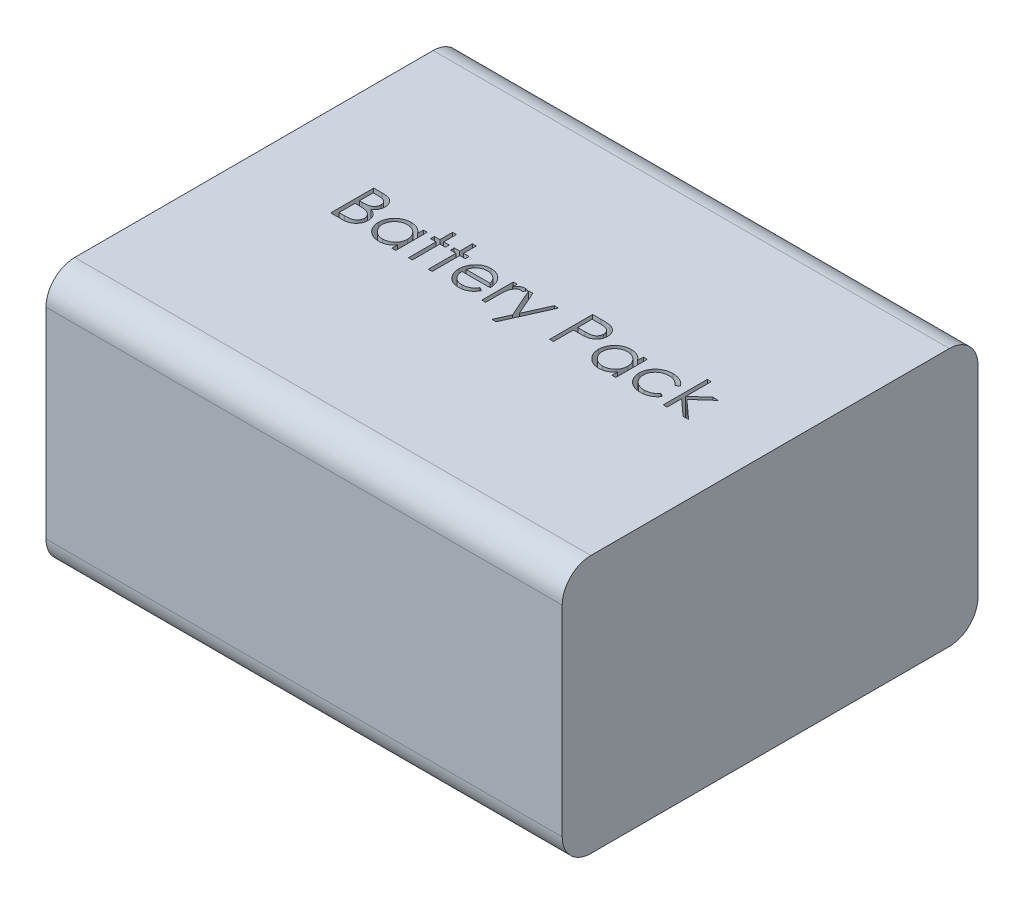
from build123d import *

# Parameters (mm, degrees)
SKETCH1_W           = 57.15
SKETCH1_H           = 46.0375
BOSS_EXTRUDE1_DEPTH = 28.575
FILLET1_R           = 3.175
CUT_EXTRUDE1_DEPTH  = 2.54


with BuildPart() as part:
    # Sketch1 → Boss-Extrude1 (new body)
    with BuildSketch(Plane(origin=(0, 0, 0), x_dir=(1, 0, 0), z_dir=(0, 1, 0))):
        Rectangle(SKETCH1_W, SKETCH1_H)
    extrude(amount=BOSS_EXTRUDE1_DEPTH)

    # Fillet1
    fillet1_edges = [part.edges().sort_by_distance(p)[0] for p in [
        (0, 28.575, -23.01875),
        (0, 0, -23.01875),
        (0, 0, 23.01875),
        (0, 28.575, 23.01875),
    ]]
    fillet(fillet1_edges, radius=FILLET1_R)

    # Sketch2 → Cut-Extrude1 (cut)
    # profile 1 of 11: a face of its own
    with BuildSketch(Plane(origin=(0, 28.575, 0), x_dir=(1, 0, 0), z_dir=(0, 1, 0))):
        with BuildLine():
            Line((-18.676878834, 3.366140696), (-17.747657079, 3.366140696))
            add(Edge.make_bspline(
                [(-17.747657079, 3.366140696), (-17.702170471, 3.36590155), (-17.614006104, 3.365438026), (-17.485800364, 3.358249194), (-17.365718947, 3.348447057), (-17.253727028, 3.332893967), (-17.149876358, 3.314127299), (-17.053853966, 3.291400899), (-16.965965196, 3.264150399), (-16.861036794, 3.22081671), (-16.741401894, 3.156423398), (-16.611864081, 3.061270601), (-16.50109617, 2.944885356), (-16.405592645, 2.813600029), (-16.329663265, 2.669179568), (-16.274732185, 2.515066172), (-16.239955219, 2.353247659), (-16.236378671, 2.24215462), (-16.234571141, 2.186009987)],
                knots=[0, 0, 0, 0, 1.001505555, 1.941167018, 2.826882275, 3.653841531, 4.429895133, 5.150066043, 5.825578002, 6.45369114, 7.647487171, 8.808567382, 9.977351308, 11.170798116, 12.373658725, 13.556498008, 14.765093433, 16, 16, 16, 16], degree=3))
            add(Edge.make_bspline(
                [(-16.234571141, 2.186009987), (-16.236058699, 2.133414902), (-16.238981891, 2.030060601), (-16.266934717, 1.87889326), (-16.310696198, 1.734996065), (-16.371527269, 1.598894177), (-16.450587485, 1.473662724), (-16.544283983, 1.35829148), (-16.657327775, 1.257665221), (-16.742023041, 1.201409342), (-16.785044399, 1.172833905)],
                knots=[0, 0, 0, 0, 1.044552857, 2.05264487, 3.044412934, 4.028983338, 5.005914585, 5.980388656, 6.974128949, 8, 8, 8, 8], degree=3))
            add(Edge.make_bspline(
                [(-16.785044399, 1.172833905), (-16.730941817, 1.152062603), (-16.627430175, 1.112321957), (-16.484982423, 1.042060843), (-16.362253009, 0.965640257), (-16.258298321, 0.882185133), (-16.16939244, 0.79222993), (-16.091759688, 0.694455649), (-16.025518246, 0.587586839), (-15.968758875, 0.472737743), (-15.924469318, 0.351081084), (-15.891300677, 0.223757992), (-15.872294969, 0.091225026), (-15.869590357, 0.001029564), (-15.868224987, -0.044503835)],
                knots=[0, 0, 0, 0, 1.27268992, 2.434971085, 3.483601985, 4.442670788, 5.356604649, 6.2567628, 7.179492994, 8.113709626, 9.066344395, 10.018646069, 10.999752585, 12, 12, 12, 12], degree=3))
            add(Edge.make_bspline(
                [(-15.868224987, -0.044503835), (-15.869554196, -0.090995186), (-15.87216945, -0.182468222), (-15.891464341, -0.316845744), (-15.924133876, -0.445263082), (-15.969134257, -0.568550848), (-16.027865835, -0.686470531), (-16.099341386, -0.799155723), (-16.18456505, -0.905474223), (-16.279900596, -1.006607438), (-16.38775373, -1.097540963), (-16.504116239, -1.178524836), (-16.630453553, -1.245126442), (-16.764690731, -1.301073599), (-16.908333604, -1.343809823), (-17.060737152, -1.373708218), (-17.221769934, -1.393853644), (-17.332273202, -1.395509912), (-17.388943137, -1.396359304)],
                knots=[0, 0, 0, 0, 0.978564426, 1.925352924, 2.850884081, 3.763762016, 4.682927383, 5.618979971, 6.567305752, 7.547517671, 8.540179244, 9.531824382, 10.526200242, 11.540722885, 12.589160233, 13.674978461, 14.80764778, 16, 16, 16, 16], degree=3))
            Line((-17.388943137, -1.396359304), (-18.676878834, -1.396359304))
            Line((-18.676878834, -1.396359304), (-18.676878834, 3.366140696))
        make_face()
        with BuildLine():
            Line((-18.249474987, 2.877679158), (-18.249474987, 1.35123685))
            Line((-18.249474987, 1.35123685), (-17.962313028, 1.35123685))
            add(Edge.make_bspline(
                [(-17.962313028, 1.35123685), (-17.920336632, 1.351781031), (-17.839229679, 1.3528325), (-17.721772963, 1.355844464), (-17.612745706, 1.36427823), (-17.512336105, 1.372709572), (-17.420702279, 1.386418208), (-17.338047239, 1.402736061), (-17.263073791, 1.419993871), (-17.176614624, 1.44934378), (-17.078543933, 1.492720188), (-16.973996031, 1.560037222), (-16.88182877, 1.640216431), (-16.80399974, 1.732732704), (-16.740302703, 1.834604193), (-16.696060826, 1.944205484), (-16.666060772, 2.05880502), (-16.663350867, 2.137479143), (-16.661974987, 2.177423749)],
                knots=[0, 0, 0, 0, 1.156816544, 2.235205308, 3.236616184, 4.169592532, 5.011045266, 5.787822928, 6.49130361, 7.128639758, 8.301311294, 9.436451833, 10.541879658, 11.654887649, 12.756523258, 13.837046038, 14.901820046, 16, 16, 16, 16], degree=3))
            add(Edge.make_bspline(
                [(-16.661974987, 2.177423749), (-16.662690968, 2.203856674), (-16.664095443, 2.255707742), (-16.675597973, 2.331294542), (-16.695148136, 2.402383363), (-16.720259157, 2.46994842), (-16.755350194, 2.531877045), (-16.796666192, 2.590310464), (-16.846584935, 2.64325874), (-16.903404707, 2.692747236), (-16.968730726, 2.736622826), (-17.04252402, 2.775050435), (-17.125782966, 2.805994135), (-17.217104386, 2.833094328), (-17.317893973, 2.8521284), (-17.426988633, 2.867985331), (-17.545281948, 2.876058097), (-17.627122248, 2.877126752), (-17.669426911, 2.877679158)],
                knots=[0, 0, 0, 0, 0.91205012, 1.789085906, 2.630437955, 3.453916878, 4.269457761, 5.079663411, 5.91843418, 6.774407191, 7.675494373, 8.627863946, 9.638891023, 10.736472738, 11.911756761, 13.175263542, 14.539845004, 16, 16, 16, 16], degree=3))
            Line((-17.669426911, 2.877679158), (-18.249474987, 2.877679158))
        make_face(mode=Mode.SUBTRACT)
        with BuildLine():
            Line((-18.249474987, 0.862775312), (-18.249474987, -0.907897765))
            Line((-18.249474987, -0.907897765), (-17.640806117, -0.907897765))
            add(Edge.make_bspline(
                [(-17.640806117, -0.907897765), (-17.597237507, -0.907375595), (-17.513264756, -0.90636918), (-17.392023439, -0.903083661), (-17.27965143, -0.895610243), (-17.176661502, -0.883845712), (-17.081941565, -0.871084322), (-16.996627905, -0.853923972), (-16.920028952, -0.834263065), (-16.831209269, -0.803872638), (-16.731191995, -0.756660654), (-16.623408651, -0.685475939), (-16.52757869, -0.600671724), (-16.44620082, -0.502522158), (-16.379508146, -0.395799531), (-16.330991259, -0.282662466), (-16.301067986, -0.164980373), (-16.297445534, -0.084743525), (-16.295628834, -0.044503835)],
                knots=[0, 0, 0, 0, 1.160039823, 2.235823828, 3.228722157, 4.157150951, 4.99529583, 5.772374946, 6.472645482, 7.099169577, 8.269452708, 9.405989375, 10.527446681, 11.663510218, 12.788923519, 13.866172445, 14.929861265, 16, 16, 16, 16], degree=3))
            add(Edge.make_bspline(
                [(-16.295628834, -0.044503835), (-16.296004533, -0.019339682), (-16.296749871, 0.030582723), (-16.307990208, 0.103946748), (-16.324337652, 0.17501124), (-16.345471496, 0.243969166), (-16.376250128, 0.309573796), (-16.412181891, 0.373122636), (-16.454311512, 0.434699691), (-16.519958038, 0.512549222), (-16.61544206, 0.602243443), (-16.751114494, 0.690060544), (-16.905381799, 0.760882739), (-17.017269923, 0.790953812), (-17.075068437, 0.806487752)],
                knots=[0, 0, 0, 0, 0.723448775, 1.435228256, 2.130040452, 2.821711965, 3.505591119, 4.210454504, 4.921174351, 5.648778258, 7.137944449, 8.670945889, 10.280296675, 12, 12, 12, 12], degree=3))
            add(Edge.make_bspline(
                [(-17.075068437, 0.806487752), (-17.098240171, 0.811189134), (-17.14848127, 0.8213827), (-17.230406585, 0.832142825), (-17.323936463, 0.841729138), (-17.429286879, 0.848820035), (-17.546591119, 0.856149582), (-17.676099712, 0.859000035), (-17.817283773, 0.862400814), (-17.915244822, 0.862647286), (-17.966129134, 0.862775312)],
                knots=[0, 0, 0, 0, 0.634451884, 1.375622551, 2.216452059, 3.157844607, 4.20941857, 5.370758133, 6.634282058, 8, 8, 8, 8], degree=3))
            Line((-17.966129134, 0.862775312), (-18.249474987, 0.862775312))
        make_face(mode=Mode.SUBTRACT)
    # profile 2 of 11: a face of its own
    with BuildSketch(Plane(origin=(0, 28.575, 0), x_dir=(1, 0, 0), z_dir=(0, 1, 0))):
        with BuildLine():
            Line((-11.472071141, 2.083929158), (-11.472071141, -1.396359304))
            Line((-11.472071141, -1.396359304), (-11.899474987, -1.396359304))
            Line((-11.899474987, -1.396359304), (-11.899474987, -0.794368619))
            add(Edge.make_bspline(
                [(-11.899474987, -0.794368619), (-11.947669842, -0.848851066), (-12.041722706, -0.955174247), (-12.198805085, -1.094078918), (-12.365313212, -1.208893705), (-12.540438939, -1.301626269), (-12.72402412, -1.371284032), (-12.915661796, -1.420795198), (-13.115430139, -1.452627524), (-13.25184495, -1.455806182), (-13.320974387, -1.457416996)],
                knots=[0, 0, 0, 0, 1.074387032, 2.096679803, 3.090159297, 4.057316773, 5.018401886, 5.985159533, 6.978961417, 8, 8, 8, 8], degree=3))
            add(Edge.make_bspline(
                [(-13.320974387, -1.457416996), (-13.382435067, -1.455748254), (-13.503638249, -1.45245742), (-13.681931386, -1.426927286), (-13.853506911, -1.385928118), (-14.018526955, -1.328912979), (-14.175923695, -1.253283361), (-14.327044756, -1.162739735), (-14.47110724, -1.054915605), (-14.605915298, -0.931651181), (-14.730055985, -0.797763716), (-14.838996502, -0.654962811), (-14.929828371, -0.503865962), (-15.005783553, -0.346386206), (-15.064289293, -0.181311262), (-15.105074845, -0.009211973), (-15.130575239, 0.169708177), (-15.133864712, 0.291545885), (-15.13553268, 0.353325191)],
                knots=[0, 0, 0, 0, 1.033919861, 2.038935746, 3.024066025, 3.998881131, 4.97069526, 5.957263378, 6.95902576, 7.993208707, 9.027059324, 10.027763471, 11.009749337, 11.988697705, 12.965288445, 13.950418724, 14.960734635, 16, 16, 16, 16], degree=3))
            add(Edge.make_bspline(
                [(-15.13553268, 0.353325191), (-15.133827744, 0.413827588), (-15.130457177, 0.533437562), (-15.105347617, 0.709348934), (-15.06312328, 0.87878271), (-15.003867102, 1.041193408), (-14.927882156, 1.196777547), (-14.835451438, 1.345645167), (-14.726568272, 1.488206383), (-14.601039104, 1.621109016), (-14.465056434, 1.743873495), (-14.319584197, 1.850565803), (-14.168241089, 1.942709087), (-14.008679635, 2.015716139), (-13.843261539, 2.074783527), (-13.670514172, 2.115649816), (-13.491156274, 2.139730814), (-13.369385283, 2.143218004), (-13.307618016, 2.14498685)],
                knots=[0, 0, 0, 0, 1.020392517, 2.01726096, 2.990465484, 3.961182959, 4.928053699, 5.906110375, 6.912531644, 7.948652711, 8.985773172, 9.998621852, 10.987621588, 11.969261332, 12.953316658, 13.946091881, 14.958173133, 16, 16, 16, 16], degree=3))
            add(Edge.make_bspline(
                [(-13.307618016, 2.14498685), (-13.236588922, 2.143030481), (-13.097304221, 2.139194134), (-12.89356718, 2.107268065), (-12.700829516, 2.053331437), (-12.517603415, 1.979965127), (-12.344546839, 1.882471678), (-12.183298135, 1.759490374), (-12.032169745, 1.61179683), (-11.944566563, 1.498353475), (-11.899474987, 1.439961309)],
                knots=[0, 0, 0, 0, 1.038897134, 2.037228247, 3.008116434, 3.962042015, 4.918381754, 5.904844433, 6.921570401, 8, 8, 8, 8], degree=3))
            Line((-11.899474987, 1.439961309), (-11.899474987, 2.083929158))
            Line((-11.899474987, 2.083929158), (-11.472071141, 2.083929158))
        make_face()
        with BuildLine():
            add(Edge.make_bspline(
                [(-13.301893858, 1.717583004), (-13.364370153, 1.71536009), (-13.487688423, 1.710972411), (-13.668723297, 1.676718476), (-13.841960479, 1.61972551), (-14.00653353, 1.541781209), (-14.159842782, 1.443770678), (-14.296858098, 1.325223367), (-14.418700131, 1.189373716), (-14.521173162, 1.036834773), (-14.604708088, 0.873306728), (-14.663446085, 0.70236776), (-14.702184597, 0.527100987), (-14.706142262, 0.408225332), (-14.708128834, 0.348555059)],
                knots=[0, 0, 0, 0, 1.031046209, 2.035121221, 3.029706178, 4.034933723, 5.034054252, 6.02443088, 7.017295772, 8.038157696, 9.050218397, 10.03989886, 11.016116709, 12, 12, 12, 12], degree=3))
            add(Edge.make_bspline(
                [(-14.708128834, 0.348555059), (-14.705591247, 0.289241378), (-14.700526019, 0.170846504), (-14.664125967, -0.004659209), (-14.603057282, -0.175638459), (-14.519724333, -0.340640025), (-14.415375747, -0.493834819), (-14.294423687, -0.632274057), (-14.155698483, -0.75132239), (-14.002036411, -0.850977803), (-13.837923423, -0.93148109), (-13.66533868, -0.987495764), (-13.487526473, -1.02366053), (-13.366623833, -1.027884836), (-13.305709963, -1.03001315)],
                knots=[0, 0, 0, 0, 0.979072187, 1.954306742, 2.945804271, 3.96968567, 4.997920485, 5.998718438, 6.996577872, 8.005894225, 9.015743152, 10.005417472, 10.995077863, 12, 12, 12, 12], degree=3))
            add(Edge.make_bspline(
                [(-13.305709963, -1.03001315), (-13.243870258, -1.027754413), (-13.120877217, -1.02326201), (-12.939305261, -0.988861431), (-12.763099615, -0.932026031), (-12.594660565, -0.853241862), (-12.437748258, -0.755600603), (-12.296917217, -0.641290954), (-12.177832989, -0.508344835), (-12.076878045, -0.362236162), (-11.997717925, -0.202063766), (-11.940056216, -0.031519743), (-11.905965008, 0.149401847), (-11.90166824, 0.27304169), (-11.899474987, 0.336152716)],
                knots=[0, 0, 0, 0, 1.01762866, 2.023962475, 3.030623092, 4.058876274, 5.077231937, 6.066672613, 7.034107872, 8.005628644, 8.981990164, 9.965428785, 10.961468474, 12, 12, 12, 12], degree=3))
            add(Edge.make_bspline(
                [(-11.899474987, 0.336152716), (-11.900780806, 0.384237406), (-11.903351069, 0.478883295), (-11.922986951, 0.617849667), (-11.954222047, 0.750837344), (-11.998235943, 0.877986146), (-12.056054441, 0.998593077), (-12.125788008, 1.113524123), (-12.208662923, 1.222181528), (-12.303345092, 1.323069064), (-12.406984171, 1.415089357), (-12.516650314, 1.497227842), (-12.633642823, 1.564703993), (-12.75599422, 1.620549438), (-12.883916786, 1.66498921), (-13.018451451, 1.694636036), (-13.158168215, 1.714992758), (-13.253480883, 1.716710498), (-13.301893858, 1.717583004)],
                knots=[0, 0, 0, 0, 1.050140795, 2.067009409, 3.05949893, 4.030605086, 5.00011959, 5.97591094, 6.962425594, 7.979863591, 8.993523472, 9.986985069, 10.967611495, 11.937549037, 12.921786183, 13.919465291, 14.943216303, 16, 16, 16, 16], degree=3))
        make_face(mode=Mode.SUBTRACT)
    # profile 3 of 11: a face of its own
    with BuildSketch(Plane(origin=(0, 28.575, 0), x_dir=(1, 0, 0), z_dir=(0, 1, 0))):
        Polygon((-10.067744218, 3.488256081), (-9.640340372, 3.488256081), (-9.640340372, 2.083929158), (-9.029763449, 2.083929158), (-9.029763449, 1.656525312), (-9.640340372, 1.656525312), (-9.640340372, -1.396359304), (-10.067744218, -1.396359304), (-10.067744218, 1.656525312), (-10.678321141, 1.656525312), (-10.678321141, 2.083929158), (-10.067744218, 2.083929158), align=None)
    # profile 4 of 11: a face of its own
    with BuildSketch(Plane(origin=(0, 28.575, 0), x_dir=(1, 0, 0), z_dir=(0, 1, 0))):
        Polygon((-7.869667295, 3.488256081), (-7.442263449, 3.488256081), (-7.442263449, 2.083929158), (-6.831686526, 2.083929158), (-6.831686526, 1.656525312), (-7.442263449, 1.656525312), (-7.442263449, -1.396359304), (-7.869667295, -1.396359304), (-7.869667295, 1.656525312), (-8.480244218, 1.656525312), (-8.480244218, 2.083929158), (-7.869667295, 2.083929158), align=None)
    # profile 5 of 11: a face of its own
    with BuildSketch(Plane(origin=(0, 28.575, 0), x_dir=(1, 0, 0), z_dir=(0, 1, 0))):
        with BuildLine():
            Line((-3.24263905, -0.297320842), (-2.862936526, -0.496712369))
            add(Edge.make_bspline(
                [(-2.862936526, -0.496712369), (-2.893194179, -0.550383473), (-2.952063589, -0.654806188), (-3.053301749, -0.798268827), (-3.159426677, -0.927329468), (-3.275228862, -1.038540177), (-3.397243675, -1.135492954), (-3.526147752, -1.220316923), (-3.662612179, -1.292596052), (-3.806643411, -1.353491456), (-3.959451015, -1.400312946), (-4.121405292, -1.433384047), (-4.292816506, -1.453826423), (-4.410308986, -1.456201061), (-4.470471081, -1.457416996)],
                knots=[0, 0, 0, 0, 1.120438281, 2.179929193, 3.190490725, 4.156257408, 5.095198341, 6.022838206, 6.959905092, 7.901321166, 8.864066838, 9.862729781, 10.905609505, 12, 12, 12, 12], degree=3))
            add(Edge.make_bspline(
                [(-4.470471081, -1.457416996), (-4.537339272, -1.455856018), (-4.667779741, -1.452811003), (-4.857653468, -1.426559471), (-5.036423319, -1.383734583), (-5.204079244, -1.323910042), (-5.360210667, -1.245767862), (-5.505127901, -1.150572996), (-5.639593042, -1.038814463), (-5.759368841, -0.909524231), (-5.867197124, -0.771164139), (-5.962346186, -0.626988454), (-6.041890048, -0.477359923), (-6.106595564, -0.323231103), (-6.158853612, -0.165573448), (-6.195275448, -0.002952487), (-6.216270927, 0.164191648), (-6.219488262, 0.277263379), (-6.221109603, 0.334244663)],
                knots=[0, 0, 0, 0, 1.145258523, 2.234067595, 3.276747158, 4.290159414, 5.277019952, 6.260822364, 7.254936242, 8.264827045, 9.274100331, 10.257902744, 11.220704747, 12.172965371, 13.118907548, 14.062713208, 15.023725156, 16, 16, 16, 16], degree=3))
            add(Edge.make_bspline(
                [(-6.221109603, 0.334244663), (-6.219668414, 0.3877137), (-6.216812168, 0.49368227), (-6.198808847, 0.650525743), (-6.16690242, 0.802964459), (-6.123119636, 0.951125083), (-6.066580262, 1.094759544), (-5.997412135, 1.233955259), (-5.915507506, 1.36856411), (-5.852271475, 1.453476946), (-5.820418497, 1.496248869)],
                knots=[0, 0, 0, 0, 1.024358464, 2.0301432, 3.019427413, 4.004406732, 4.986367066, 5.972626655, 6.978780325, 8, 8, 8, 8], degree=3))
            add(Edge.make_bspline(
                [(-5.820418497, 1.496248869), (-5.7772734, 1.547777582), (-5.692349934, 1.649202708), (-5.548717893, 1.782468787), (-5.393187983, 1.894106924), (-5.227709306, 1.986645206), (-5.050358604, 2.056958275), (-4.86351989, 2.109356093), (-4.665065717, 2.1387176), (-4.529395399, 2.142864831), (-4.45997679, 2.14498685)],
                knots=[0, 0, 0, 0, 1.030682036, 2.02871468, 2.997146059, 3.962720338, 4.930598197, 5.918074684, 6.934738563, 8, 8, 8, 8], degree=3))
            add(Edge.make_bspline(
                [(-4.45997679, 2.14498685), (-4.388610585, 2.143144376), (-4.248606357, 2.139529863), (-4.044455507, 2.106020459), (-3.851287532, 2.052881091), (-3.669179731, 1.97783254), (-3.498113642, 1.881004721), (-3.339201196, 1.761068858), (-3.189724674, 1.621707104), (-3.102763357, 1.51453288), (-3.058511947, 1.459995865)],
                knots=[0, 0, 0, 0, 1.056321875, 2.072262726, 3.055038591, 4.01806755, 4.982017516, 5.957941055, 6.960871419, 8, 8, 8, 8], degree=3))
            add(Edge.make_bspline(
                [(-3.058511947, 1.459995865), (-3.028403506, 1.41889742), (-2.968387034, 1.336974094), (-2.893211516, 1.203391198), (-2.827955204, 1.063631425), (-2.775794996, 0.915435628), (-2.733559103, 0.760559699), (-2.703001789, 0.597896451), (-2.685081701, 0.427494322), (-2.681559223, 0.311389259), (-2.679763449, 0.252198389)],
                knots=[0, 0, 0, 0, 0.94817472, 1.890038105, 2.849395472, 3.817997239, 4.812318967, 5.836947057, 6.897266129, 8, 8, 8, 8], degree=3))
            Line((-2.679763449, 0.252198389), (-5.793705757, 0.252198389))
            add(Edge.make_bspline(
                [(-5.793705757, 0.252198389), (-5.791610792, 0.206341685), (-5.787491129, 0.116166328), (-5.768284452, -0.015783202), (-5.738010228, -0.141476928), (-5.695461968, -0.259972067), (-5.64393601, -0.372816276), (-5.580818303, -0.479172477), (-5.505516981, -0.578556232), (-5.42152594, -0.671856515), (-5.328035214, -0.754942765), (-5.229679047, -0.829308218), (-5.125048875, -0.891636548), (-5.014969697, -0.942227755), (-4.899619518, -0.981833135), (-4.778961995, -1.008867562), (-4.653234558, -1.026974733), (-4.56752897, -1.028988134), (-4.523896562, -1.03001315)],
                knots=[0, 0, 0, 0, 1.094153842, 2.151609401, 3.174256925, 4.172055639, 5.149267565, 6.128595816, 7.11444997, 8.118368179, 9.117203808, 10.09244225, 11.054858984, 12.015122123, 12.976791628, 13.957293641, 14.960065497, 16, 16, 16, 16], degree=3))
            add(Edge.make_bspline(
                [(-4.523896562, -1.03001315), (-4.481236608, -1.029185758), (-4.396591075, -1.027544055), (-4.270533337, -1.011580276), (-4.14651848, -0.985767151), (-4.025059785, -0.950538272), (-3.908622312, -0.907571198), (-3.80079176, -0.855724096), (-3.701622609, -0.798370333), (-3.60893488, -0.73277074), (-3.519031135, -0.652477456), (-3.429846538, -0.552280279), (-3.334220092, -0.433779036), (-3.274362824, -0.344590112), (-3.24263905, -0.297320842)],
                knots=[0, 0, 0, 0, 0.99110716, 1.966546729, 2.947904876, 3.932708344, 4.903319531, 5.828989031, 6.710028674, 7.56322171, 8.463672341, 9.504779593, 10.677557249, 12, 12, 12, 12], degree=3))
        make_face()
        with BuildLine():
            add(Edge.make_bspline(
                [(-3.107167295, 0.679602235), (-3.122810916, 0.736293502), (-3.152919852, 0.845405943), (-3.215834333, 0.996500869), (-3.286688823, 1.130786906), (-3.370538393, 1.247236335), (-3.46554173, 1.350655401), (-3.575276782, 1.441032119), (-3.698334194, 1.521882293), (-3.834077882, 1.590125516), (-3.977826168, 1.648214216), (-4.128329594, 1.68716482), (-4.281896798, 1.713847804), (-4.385765952, 1.716332616), (-4.438034182, 1.717583004)],
                knots=[0, 0, 0, 0, 1.154881502, 2.222775134, 3.210006277, 4.132804581, 5.035138423, 5.962687519, 6.919655026, 7.923214229, 8.944639381, 9.960483929, 10.97369054, 12, 12, 12, 12], degree=3))
            add(Edge.make_bspline(
                [(-4.438034182, 1.717583004), (-4.480691811, 1.716750694), (-4.565016975, 1.715105391), (-4.689251643, 1.699497823), (-4.808558662, 1.673698891), (-4.923818357, 1.638368003), (-5.033520324, 1.591275584), (-5.139921062, 1.536053407), (-5.240315101, 1.468641467), (-5.303100221, 1.417262453), (-5.334819038, 1.391305961)],
                knots=[0, 0, 0, 0, 1.04873581, 2.073130211, 3.073294108, 4.04793562, 5.032784715, 6.005352987, 6.992311501, 8, 8, 8, 8], degree=3))
            add(Edge.make_bspline(
                [(-5.334819038, 1.391305961), (-5.357533825, 1.37076691), (-5.403503019, 1.329200877), (-5.464926371, 1.257587563), (-5.523737086, 1.180364902), (-5.577258949, 1.0945785), (-5.626350236, 1.001205226), (-5.672287919, 0.901032658), (-5.713635144, 0.793300649), (-5.736898066, 0.718226722), (-5.748866514, 0.679602235)],
                knots=[0, 0, 0, 0, 0.879870761, 1.780643979, 2.707998968, 3.669668524, 4.684282772, 5.740141944, 6.837334558, 8, 8, 8, 8], degree=3))
            Line((-5.748866514, 0.679602235), (-3.107167295, 0.679602235))
        make_face(mode=Mode.SUBTRACT)
    # profile 6 of 11: a face of its own
    with BuildSketch(Plane(origin=(0, 28.575, 0), x_dir=(1, 0, 0), z_dir=(0, 1, 0))):
        with BuildLine():
            Line((-1.947071141, 2.083929158), (-1.519667295, 2.083929158))
            Line((-1.519667295, 2.083929158), (-1.519667295, 1.571616958))
            add(Edge.make_bspline(
                [(-1.519667295, 1.571616958), (-1.48811402, 1.619317925), (-1.427768626, 1.710545652), (-1.32746639, 1.831199237), (-1.224727929, 1.93109614), (-1.119061406, 2.010702713), (-1.009689777, 2.07031985), (-0.899013425, 2.113989301), (-0.785291089, 2.139812005), (-0.708870756, 2.143259591), (-0.670583762, 2.14498685)],
                knots=[0, 0, 0, 0, 1.2804753, 2.448899062, 3.506932113, 4.484331642, 5.4025378, 6.288909075, 7.142734305, 8, 8, 8, 8], degree=3))
            add(Edge.make_bspline(
                [(-0.670583762, 2.14498685), (-0.640884367, 2.143366884), (-0.579775933, 2.140033697), (-0.487271052, 2.116614682), (-0.391961927, 2.079224944), (-0.330536035, 2.044063784), (-0.298513449, 2.025733545)],
                knots=[0, 0, 0, 0, 0.901110191, 1.854092781, 2.881294221, 4, 4, 4, 4], degree=3))
            Line((-0.298513449, 2.025733545), (-0.533203954, 1.655571285))
            add(Edge.make_bspline(
                [(-0.533203954, 1.655571285), (-0.553763015, 1.664742862), (-0.592788048, 1.682152269), (-0.649876226, 1.702756219), (-0.702510473, 1.714888233), (-0.736043315, 1.716726173), (-0.751676009, 1.717583004)],
                knots=[0, 0, 0, 0, 1.180555205, 2.24091978, 3.179933427, 4, 4, 4, 4], degree=3))
            add(Edge.make_bspline(
                [(-0.751676009, 1.717583004), (-0.785973811, 1.715296953), (-0.855931384, 1.710634072), (-0.958644221, 1.673978051), (-1.05831274, 1.614752635), (-1.137467752, 1.549069444), (-1.198757389, 1.485731191), (-1.242491053, 1.430420329), (-1.282608648, 1.368400834), (-1.320940269, 1.300732943), (-1.355864762, 1.226261259), (-1.388460223, 1.145729815), (-1.417931747, 1.059045337), (-1.434736901, 0.998653407), (-1.44334518, 0.96771822)],
                knots=[0, 0, 0, 0, 1.125678352, 2.296057538, 3.5422874, 4.923748041, 5.663163013, 6.437101912, 7.23742474, 8.08941207, 8.991984279, 9.93940061, 10.944477711, 12, 12, 12, 12], degree=3))
            add(Edge.make_bspline(
                [(-1.44334518, 0.96771822), (-1.449784615, 0.940126781), (-1.464047475, 0.879013838), (-1.477915246, 0.776486024), (-1.491616983, 0.65535026), (-1.501273453, 0.51526936), (-1.510224289, 0.356593142), (-1.515272651, 0.179079873), (-1.519495138, -0.017452651), (-1.519608169, -0.154849896), (-1.519667295, -0.226722885)],
                knots=[0, 0, 0, 0, 0.566838948, 1.255505196, 2.06880316, 3.007127437, 4.065329342, 5.249902469, 6.561414163, 8, 8, 8, 8], degree=3))
            Line((-1.519667295, -0.226722885), (-1.519667295, -1.396359304))
            Line((-1.519667295, -1.396359304), (-1.947071141, -1.396359304))
            Line((-1.947071141, -1.396359304), (-1.947071141, 2.083929158))
        make_face()
    # profile 7 of 11: a face of its own
    with BuildSketch(Plane(origin=(0, 28.575, 0), x_dir=(1, 0, 0), z_dir=(0, 1, 0))):
        Polygon((-0.237455757, 2.083929158), (0.223339015, 2.083929158), (1.401561671, -0.581620722), (2.59791083, 2.083929158), (3.059659628, 2.083929158), (0.922640397, -2.678570842), (0.460891599, -2.678570842), (1.169733246, -1.09965708), align=None)
    # profile 8 of 11: a face of its own
    with BuildSketch(Plane(origin=(0, 28.575, 0), x_dir=(1, 0, 0), z_dir=(0, 1, 0))):
        with BuildLine():
            Line((5.563025013, 3.366140696), (6.4970169, 3.366140696))
            add(Edge.make_bspline(
                [(6.4970169, 3.366140696), (6.561257454, 3.36607008), (6.684345209, 3.365934777), (6.860850339, 3.361832569), (7.021155723, 3.356353392), (7.164915706, 3.34875803), (7.292572611, 3.339781955), (7.403548794, 3.327192573), (7.498716547, 3.314047671), (7.555739251, 3.300683543), (7.581744964, 3.294588713)],
                knots=[0, 0, 0, 0, 1.415646017, 2.712440637, 3.8905458, 4.950247383, 5.884950622, 6.709939814, 7.411656543, 8, 8, 8, 8], degree=3))
            add(Edge.make_bspline(
                [(7.581744964, 3.294588713), (7.614665451, 3.285578131), (7.679730695, 3.267769291), (7.773485329, 3.232099903), (7.862685383, 3.189805957), (7.947636897, 3.141604096), (8.027295945, 3.085426239), (8.102851023, 3.023549638), (8.173635353, 2.954545682), (8.23925089, 2.879188318), (8.299509846, 2.798742604), (8.35139345, 2.712007641), (8.394837284, 2.620443403), (8.432098093, 2.524113579), (8.458915669, 2.422209246), (8.479118057, 2.31543847), (8.491940922, 2.203812695), (8.49316905, 2.127531232), (8.493794243, 2.08869929)],
                knots=[0, 0, 0, 0, 0.999701418, 1.975846123, 2.934577507, 3.890451536, 4.834027766, 5.787354733, 6.749476667, 7.726910423, 8.712836071, 9.690891519, 10.682875813, 11.679750201, 12.712814741, 13.765529915, 14.8625177, 16, 16, 16, 16], degree=3))
            add(Edge.make_bspline(
                [(8.493794243, 2.08869929), (8.493220805, 2.049540958), (8.492098833, 1.972925037), (8.478632816, 1.860839207), (8.460494234, 1.753725969), (8.432603602, 1.651822824), (8.396074311, 1.555734936), (8.353222625, 1.463993903), (8.301537893, 1.378160492), (8.24214975, 1.297923093), (8.176084901, 1.223206391), (8.103622868, 1.154551831), (8.025056188, 1.092361285), (7.94063455, 1.036495332), (7.849534935, 0.988249465), (7.753139004, 0.945036847), (7.650608888, 0.908745154), (7.579657825, 0.889654249), (7.543583907, 0.879947788)],
                knots=[0, 0, 0, 0, 1.121902311, 2.195077645, 3.232258892, 4.234102512, 5.217864754, 6.176164875, 7.132989551, 8.084763148, 9.034132444, 9.988522005, 10.94243251, 11.903244335, 12.886203696, 13.894208494, 14.929344452, 16, 16, 16, 16], degree=3))
            add(Edge.make_bspline(
                [(7.543583907, 0.879947788), (7.51374707, 0.873602803), (7.448357908, 0.859697399), (7.340667275, 0.844173749), (7.215283732, 0.830923657), (7.072378416, 0.820988894), (6.912079599, 0.812483929), (6.734300566, 0.805723772), (6.53869234, 0.802009221), (6.402251826, 0.801817643), (6.331016299, 0.801717619)],
                knots=[0, 0, 0, 0, 0.601384939, 1.31797006, 2.144135048, 3.087295005, 4.142315834, 5.309527816, 6.595305764, 8, 8, 8, 8], degree=3))
            Line((6.331016299, 0.801717619), (5.990428859, 0.801717619))
            Line((5.990428859, 0.801717619), (5.990428859, -1.396359304))
            Line((5.990428859, -1.396359304), (5.563025013, -1.396359304))
            Line((5.563025013, -1.396359304), (5.563025013, 3.366140696))
        make_face()
        with BuildLine():
            Line((5.990428859, 2.877679158), (5.990428859, 1.290179158))
            Line((5.990428859, 1.290179158), (6.824247969, 1.279684867))
            add(Edge.make_bspline(
                [(6.824247969, 1.279684867), (6.86496044, 1.279663825), (6.943555025, 1.279623205), (7.057087886, 1.285045956), (7.162419809, 1.291305966), (7.259227249, 1.300471634), (7.347553845, 1.313427345), (7.427546876, 1.326506174), (7.498586071, 1.345427399), (7.581724628, 1.370904147), (7.674366611, 1.414355313), (7.775151383, 1.477424271), (7.860564216, 1.557816234), (7.934475899, 1.648205533), (7.993130683, 1.748761135), (8.036069372, 1.856351366), (8.06129859, 1.969872833), (8.064681589, 2.047553479), (8.066390397, 2.086791237)],
                knots=[0, 0, 0, 0, 1.160613943, 2.240541288, 3.23993089, 4.169200891, 5.011653406, 5.7853311, 6.478053781, 7.106038997, 8.262395093, 9.384106736, 10.481365981, 11.59014053, 12.70357646, 13.786202915, 14.881775077, 16, 16, 16, 16], degree=3))
            add(Edge.make_bspline(
                [(8.066390397, 2.086791237), (8.064672296, 2.125079714), (8.061256924, 2.201192468), (8.035871624, 2.312742139), (7.993214165, 2.41919858), (7.934082156, 2.518494099), (7.862316547, 2.60855815), (7.778905655, 2.686795313), (7.684045824, 2.749689844), (7.59580591, 2.790284416), (7.517427153, 2.815070202), (7.449347951, 2.832412288), (7.372480283, 2.846258381), (7.286799126, 2.85746999), (7.192968577, 2.867067736), (7.090182513, 2.873580083), (6.978830305, 2.877392065), (6.90152735, 2.877581143), (6.861455001, 2.877679158)],
                knots=[0, 0, 0, 0, 1.120700087, 2.227813068, 3.331159281, 4.466773991, 5.599788987, 6.693661531, 7.80175334, 8.91857717, 9.525282508, 10.207424825, 10.974604443, 11.810962634, 12.737642355, 13.736264703, 14.826523623, 16, 16, 16, 16], degree=3))
            Line((6.861455001, 2.877679158), (5.990428859, 2.877679158))
        make_face(mode=Mode.SUBTRACT)
    # profile 9 of 11: a face of its own
    with BuildSketch(Plane(origin=(0, 28.575, 0), x_dir=(1, 0, 0), z_dir=(0, 1, 0))):
        with BuildLine():
            Line((12.889948089, 2.083929158), (12.889948089, -1.396359304))
            Line((12.889948089, -1.396359304), (12.462544243, -1.396359304))
            Line((12.462544243, -1.396359304), (12.462544243, -0.794368619))
            add(Edge.make_bspline(
                [(12.462544243, -0.794368619), (12.414349389, -0.848851066), (12.320296525, -0.955174247), (12.163214146, -1.094078918), (11.996706018, -1.208893705), (11.821580292, -1.301626269), (11.637995111, -1.371284032), (11.446357435, -1.420795198), (11.246589092, -1.452627524), (11.110174281, -1.455806182), (11.041044844, -1.457416996)],
                knots=[0, 0, 0, 0, 1.074387032, 2.096679803, 3.090159297, 4.057316773, 5.018401886, 5.985159533, 6.978961417, 8, 8, 8, 8], degree=3))
            add(Edge.make_bspline(
                [(11.041044844, -1.457416996), (10.979584164, -1.455748254), (10.858380982, -1.45245742), (10.680087845, -1.426927286), (10.50851232, -1.385928118), (10.343492276, -1.328912979), (10.186095535, -1.253283361), (10.034974475, -1.162739735), (9.890911991, -1.054915605), (9.756103932, -0.931651181), (9.631963246, -0.797763716), (9.523022729, -0.654962811), (9.432190859, -0.503865962), (9.356235678, -0.346386206), (9.297729938, -0.181311262), (9.256944386, -0.009211973), (9.231443992, 0.169708177), (9.228154519, 0.291545885), (9.226486551, 0.353325191)],
                knots=[0, 0, 0, 0, 1.033919861, 2.038935746, 3.024066025, 3.998881131, 4.97069526, 5.957263378, 6.95902576, 7.993208707, 9.027059324, 10.027763471, 11.009749337, 11.988697705, 12.965288445, 13.950418724, 14.960734635, 16, 16, 16, 16], degree=3))
            add(Edge.make_bspline(
                [(9.226486551, 0.353325191), (9.228191487, 0.413827588), (9.231562054, 0.533437562), (9.256671614, 0.709348934), (9.29889595, 0.87878271), (9.358152129, 1.041193408), (9.434137075, 1.196777547), (9.526567793, 1.345645167), (9.635450959, 1.488206383), (9.760980127, 1.621109016), (9.896962797, 1.743873495), (10.042435034, 1.850565803), (10.193778142, 1.942709087), (10.353339595, 2.015716139), (10.518757692, 2.074783527), (10.691505059, 2.115649816), (10.870862957, 2.139730814), (10.992633948, 2.143218004), (11.054401214, 2.14498685)],
                knots=[0, 0, 0, 0, 1.020392517, 2.01726096, 2.990465484, 3.961182959, 4.928053699, 5.906110375, 6.912531644, 7.948652711, 8.985773172, 9.998621852, 10.987621588, 11.969261332, 12.953316658, 13.946091881, 14.958173133, 16, 16, 16, 16], degree=3))
            add(Edge.make_bspline(
                [(11.054401214, 2.14498685), (11.125430308, 2.143030481), (11.264715009, 2.139194134), (11.46845205, 2.107268065), (11.661189715, 2.053331437), (11.844415815, 1.979965127), (12.017472392, 1.882471678), (12.178721096, 1.759490374), (12.329849485, 1.61179683), (12.417452668, 1.498353475), (12.462544243, 1.439961309)],
                knots=[0, 0, 0, 0, 1.038897134, 2.037228247, 3.008116434, 3.962042015, 4.918381754, 5.904844433, 6.921570401, 8, 8, 8, 8], degree=3))
            Line((12.462544243, 1.439961309), (12.462544243, 2.083929158))
            Line((12.462544243, 2.083929158), (12.889948089, 2.083929158))
        make_face()
        with BuildLine():
            add(Edge.make_bspline(
                [(11.060125373, 1.717583004), (10.997649078, 1.71536009), (10.874330808, 1.710972411), (10.693295933, 1.676718476), (10.520058752, 1.61972551), (10.355485701, 1.541781209), (10.202176449, 1.443770678), (10.065161133, 1.325223367), (9.9433191, 1.189373716), (9.840846069, 1.036834773), (9.757311143, 0.873306728), (9.698573146, 0.70236776), (9.659834634, 0.527100987), (9.655876969, 0.408225332), (9.653890397, 0.348555059)],
                knots=[0, 0, 0, 0, 1.031046209, 2.035121221, 3.029706178, 4.034933723, 5.034054252, 6.02443088, 7.017295772, 8.038157696, 9.050218397, 10.03989886, 11.016116709, 12, 12, 12, 12], degree=3))
            add(Edge.make_bspline(
                [(9.653890397, 0.348555059), (9.656427984, 0.289241378), (9.661493212, 0.170846504), (9.697893264, -0.004659209), (9.758961949, -0.175638459), (9.842294898, -0.340640025), (9.946643484, -0.493834819), (10.067595543, -0.632274057), (10.206320748, -0.75132239), (10.35998282, -0.850977803), (10.524095808, -0.93148109), (10.69668055, -0.987495764), (10.874492758, -1.02366053), (10.995395398, -1.027884836), (11.056309267, -1.03001315)],
                knots=[0, 0, 0, 0, 0.979072187, 1.954306742, 2.945804271, 3.96968567, 4.997920485, 5.998718438, 6.996577872, 8.005894225, 9.015743152, 10.005417472, 10.995077863, 12, 12, 12, 12], degree=3))
            add(Edge.make_bspline(
                [(11.056309267, -1.03001315), (11.118148973, -1.027754413), (11.241142014, -1.02326201), (11.42271397, -0.988861431), (11.598919616, -0.932026031), (11.767358666, -0.853241862), (11.924270973, -0.755600603), (12.065102013, -0.641290954), (12.184186242, -0.508344835), (12.285141186, -0.362236162), (12.364301306, -0.202063766), (12.421963015, -0.031519743), (12.456054223, 0.149401847), (12.460350991, 0.27304169), (12.462544243, 0.336152716)],
                knots=[0, 0, 0, 0, 1.01762866, 2.023962475, 3.030623092, 4.058876274, 5.077231937, 6.066672613, 7.034107872, 8.005628644, 8.981990164, 9.965428785, 10.961468474, 12, 12, 12, 12], degree=3))
            add(Edge.make_bspline(
                [(12.462544243, 0.336152716), (12.461238425, 0.384237406), (12.458668162, 0.478883295), (12.43903228, 0.617849667), (12.407797183, 0.750837344), (12.363783288, 0.877986146), (12.30596479, 0.998593077), (12.236231223, 1.113524123), (12.153356307, 1.222181528), (12.058674139, 1.323069064), (11.95503506, 1.415089357), (11.845368917, 1.497227842), (11.728376408, 1.564703993), (11.606025011, 1.620549438), (11.478102445, 1.66498921), (11.34356778, 1.694636036), (11.203851016, 1.714992758), (11.108538348, 1.716710498), (11.060125373, 1.717583004)],
                knots=[0, 0, 0, 0, 1.050140795, 2.067009409, 3.05949893, 4.030605086, 5.00011959, 5.97591094, 6.962425594, 7.979863591, 8.993523472, 9.986985069, 10.967611495, 11.937549037, 12.921786183, 13.919465291, 14.943216303, 16, 16, 16, 16], degree=3))
        make_face(mode=Mode.SUBTRACT)
    # profile 10 of 11: a face of its own
    with BuildSketch(Plane(origin=(0, 28.575, 0), x_dir=(1, 0, 0), z_dir=(0, 1, 0))):
        with BuildLine():
            Line((17.286101936, 1.329294242), (16.92834202, 1.107006081))
            add(Edge.make_bspline(
                [(16.92834202, 1.107006081), (16.88911281, 1.155758288), (16.811896771, 1.251718731), (16.677813025, 1.375557248), (16.534922493, 1.481920258), (16.380783435, 1.568602862), (16.215612043, 1.635579193), (16.040059692, 1.682973151), (15.854151416, 1.712506424), (15.726699841, 1.715863084), (15.661394904, 1.717583004)],
                knots=[0, 0, 0, 0, 1.026593902, 2.0206758, 2.988051866, 3.946915611, 4.916868779, 5.907761954, 6.927957743, 8, 8, 8, 8], degree=3))
            add(Edge.make_bspline(
                [(15.661394904, 1.717583004), (15.609199324, 1.716144944), (15.506401547, 1.713312723), (15.355489959, 1.695609159), (15.2117409, 1.66343914), (15.074253364, 1.621051589), (14.944005223, 1.564241373), (14.820655224, 1.495103812), (14.703109253, 1.414753578), (14.594773616, 1.321666372), (14.495674146, 1.220431042), (14.409814552, 1.111909049), (14.335061082, 0.999350912), (14.276406192, 0.879945862), (14.228406763, 0.75642559), (14.196829047, 0.626458522), (14.175786015, 0.491709697), (14.173378465, 0.399836528), (14.172159628, 0.353325191)],
                knots=[0, 0, 0, 0, 1.112346261, 2.190735716, 3.231507886, 4.247384806, 5.251966152, 6.253067467, 7.256802811, 8.280671706, 9.291813951, 10.270744147, 11.225547591, 12.165006084, 13.100104208, 14.043489273, 15.009504848, 16, 16, 16, 16], degree=3))
            add(Edge.make_bspline(
                [(14.172159628, 0.353325191), (14.174580682, 0.292407086), (14.179390168, 0.171391695), (14.21708394, -0.007240293), (14.278784723, -0.179947172), (14.363227727, -0.345502744), (14.470012685, -0.49871122), (14.595433208, -0.636120849), (14.739558818, -0.755069087), (14.901119597, -0.853683488), (15.076322098, -0.932960563), (15.263270776, -0.989440184), (15.460437977, -1.023529305), (15.595430015, -1.027823642), (15.664256984, -1.03001315)],
                knots=[0, 0, 0, 0, 0.966302908, 1.919585723, 2.883856336, 3.870342332, 4.860282998, 5.839159637, 6.814385684, 7.815993281, 8.834850808, 9.858348828, 10.908058873, 12, 12, 12, 12], degree=3))
            add(Edge.make_bspline(
                [(15.664256984, -1.03001315), (15.727333145, -1.028244905), (15.851294541, -1.024769836), (16.032497168, -0.995475068), (16.205008404, -0.947518552), (16.368822117, -0.880642643), (16.523638972, -0.794199844), (16.66845867, -0.687575401), (16.806162872, -0.56383667), (16.887121258, -0.468154002), (16.92834202, -0.419436227)],
                knots=[0, 0, 0, 0, 1.039848629, 2.043578496, 3.018386758, 3.987534228, 4.954977003, 5.934852016, 6.948509513, 8, 8, 8, 8], degree=3))
            Line((16.92834202, -0.419436227), (17.286101936, -0.654126732))
            add(Edge.make_bspline(
                [(17.286101936, -0.654126732), (17.264891527, -0.685274471), (17.222541108, -0.747466566), (17.151746375, -0.835156596), (17.075383318, -0.917237171), (16.993749854, -0.993598266), (16.907911902, -1.066067213), (16.814937139, -1.131179534), (16.717823489, -1.192595133), (16.615430885, -1.247857648), (16.508817971, -1.297532321), (16.398134764, -1.340246736), (16.283862233, -1.376945344), (16.165866021, -1.406115448), (16.043913502, -1.42939841), (15.918320071, -1.444847554), (15.789128983, -1.45637999), (15.70180902, -1.457068331), (15.657578799, -1.457416996)],
                knots=[0, 0, 0, 0, 0.954134338, 1.905101784, 2.851144739, 3.791306361, 4.734911809, 5.6936923, 6.663572882, 7.643865596, 8.638447847, 9.640600242, 10.646758161, 11.676244097, 12.717260333, 13.78922464, 14.880174919, 16, 16, 16, 16], degree=3))
            add(Edge.make_bspline(
                [(15.657578799, -1.457416996), (15.59007256, -1.456204219), (15.457759844, -1.453827167), (15.264099574, -1.42768992), (15.079023834, -1.388286878), (14.902595854, -1.331730511), (14.734788168, -1.258925799), (14.575757246, -1.169993712), (14.426029664, -1.064195741), (14.287086063, -0.943414972), (14.15947631, -0.812458957), (14.049903172, -0.67114889), (13.954863715, -0.524680179), (13.878544594, -0.369817931), (13.817792883, -0.208620406), (13.776284522, -0.039796258), (13.749437986, 0.135262702), (13.746330959, 0.254642088), (13.744755782, 0.315164134)],
                knots=[0, 0, 0, 0, 1.1129367, 2.181364009, 3.217532258, 4.231199276, 5.232079859, 6.230262199, 7.231623845, 8.250719726, 9.263571943, 10.242672461, 11.195837495, 12.138959767, 13.085126421, 14.0317438, 15.002148558, 16, 16, 16, 16], degree=3))
            add(Edge.make_bspline(
                [(13.744755782, 0.315164134), (13.745355879, 0.356228361), (13.746549571, 0.437911886), (13.760240979, 0.559144816), (13.777928187, 0.67876323), (13.807898922, 0.795250876), (13.842516353, 0.910374503), (13.886706273, 1.022746509), (13.938543221, 1.132889081), (13.997396764, 1.240518492), (14.063648235, 1.343864115), (14.136965199, 1.441500352), (14.214586242, 1.534600104), (14.300142666, 1.619949222), (14.390003766, 1.700960968), (14.486711875, 1.77547113), (14.589712301, 1.843698692), (14.69745818, 1.906905253), (14.809886805, 1.963183627), (14.926318595, 2.011670283), (15.046051967, 2.053107538), (15.169278449, 2.085912888), (15.295180135, 2.113423025), (15.42474917, 2.13072838), (15.557489872, 2.14295613), (15.647373246, 2.144304315), (15.692877777, 2.14498685)],
                knots=[0, 0, 0, 0, 0.990994727, 1.971252077, 2.943264845, 3.907940874, 4.872158414, 5.844625996, 6.82015047, 7.809835459, 8.804511986, 9.781214284, 10.756496977, 11.728388426, 12.696359165, 13.676225489, 14.672885716, 15.677705647, 16.690706858, 17.706033469, 18.721040654, 19.747369689, 20.783475414, 21.830280724, 22.901553713, 24, 24, 24, 24], degree=3))
            add(Edge.make_bspline(
                [(15.692877777, 2.14498685), (15.749864638, 2.14373242), (15.863553514, 2.141229829), (16.032201404, 2.120167806), (16.198365293, 2.088413611), (16.359129744, 2.041369868), (16.512545537, 1.984405393), (16.656149132, 1.920434521), (16.78656013, 1.846146864), (16.906204457, 1.764884852), (17.015305872, 1.673225905), (17.114984306, 1.570074295), (17.2072838, 1.455966864), (17.259612397, 1.371866923), (17.286101936, 1.329294242)],
                knots=[0, 0, 0, 0, 1.095225653, 2.184976855, 3.262915854, 4.344593502, 5.400796181, 6.407717688, 7.363229445, 8.282371371, 9.184954523, 10.097238608, 11.036792983, 12, 12, 12, 12], degree=3))
        make_face()
    # profile 11 of 11: a face of its own
    with BuildSketch(Plane(origin=(0, 28.575, 0), x_dir=(1, 0, 0), z_dir=(0, 1, 0))):
        Polygon((18.140909628, 3.488256081), (18.568313474, 3.488256081), (18.568313474, 0.664337812), (20.151997368, 2.083929158), (20.766390397, 2.083929158), (18.928935469, 0.435371466), (20.949563474, -1.396359304), (20.336124472, -1.396359304), (18.568313474, 0.207359146), (18.568313474, -1.396359304), (18.140909628, -1.396359304), align=None)
    extrude(amount=-CUT_EXTRUDE1_DEPTH, mode=Mode.SUBTRACT)


solid = part.part
